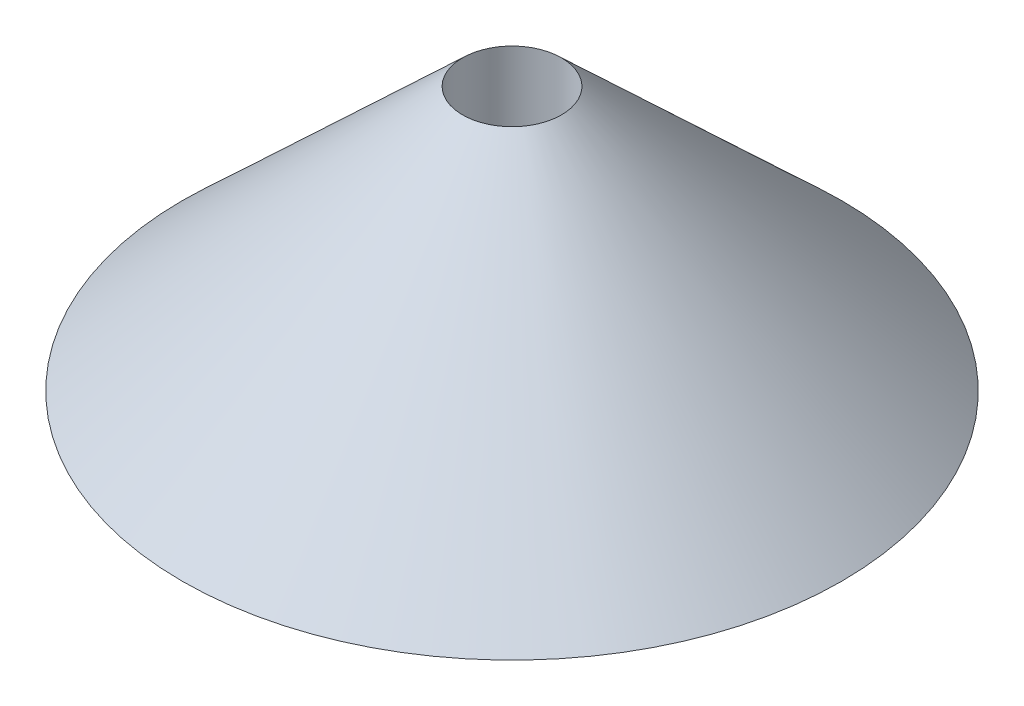
from build123d import *


with BuildPart() as part:
    # Croquis2 → Revolución1 (revolve)
    with BuildSketch(Plane.XY, mode=Mode.PRIVATE) as revoluci_n1_sk:
        Polygon((-32.812131413, 3.639340419), (-42.812131413, 3.639340419), (-34.312131413, 11.639340419), (-34.312131413, 6.639340419), (-32.812131413, 6.639340419), align=None)
    revolve(revoluci_n1_sk.sketch.rotate(Axis((-32.812131413, 3.639340419, 0), (0, 1, 0)), 270), axis=Axis((-32.812131413, 3.639340419, 0), (0, 1, 0)))


solid = part.part
